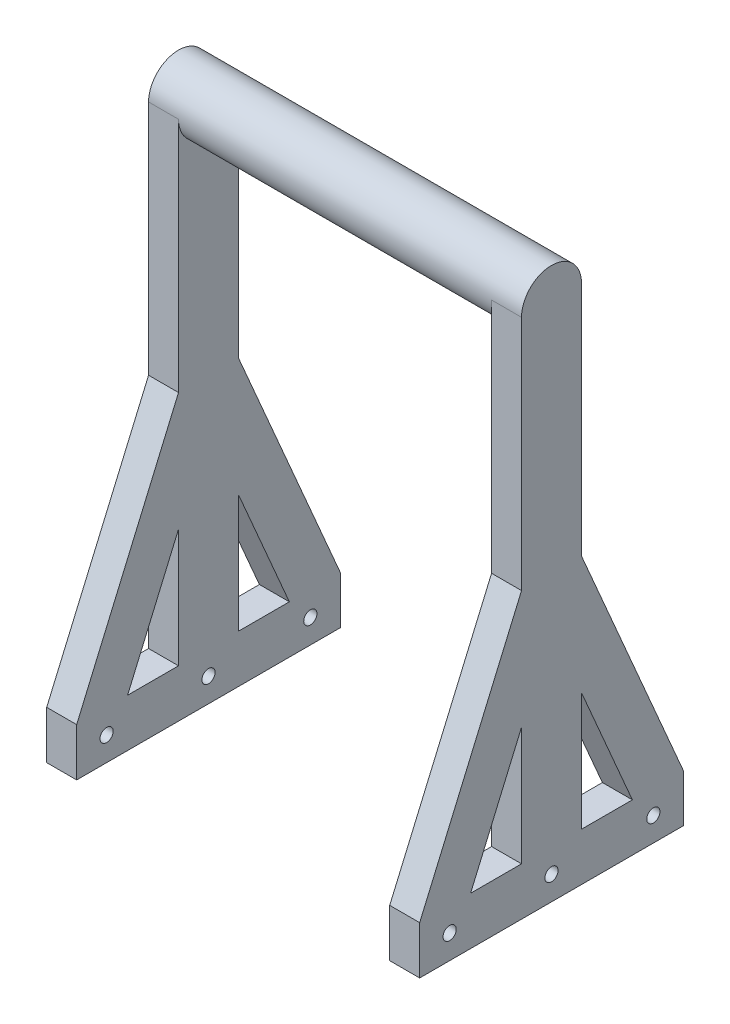
from build123d import *

# Parameters (mm, degrees)
SKETCH_2_W          = 10
SKETCH_2_H          = 88
EXTRUDE_1_DEPTH     = 16
EXTRUDE_1_2_DEPTH   = 16
SKETCH_3_W          = 10
SKETCH_3_H          = 20
EXTRUDE_2_DEPTH     = 158
SKETCH_4_R          = 10
EXTRUDE_3_DEPTH     = 124.5
SKETCH_5_R          = 2.2
CUT_EXTRUDE_1_DEPTH = 126
EXTRUDE_4_DEPTH     = 10
EXTRUDE_5_DEPTH     = 10


with BuildPart() as part:
    # 草图2 → 凸台-拉伸1 (new body)
    with BuildSketch(Plane(origin=(0, 0, 0), x_dir=(1, 0, 0), z_dir=(0, 1, 0))):
        with Locations((-57.25, 0)):
            Rectangle(SKETCH_2_W, SKETCH_2_H)
    extrude(amount=EXTRUDE_1_DEPTH)



with BuildPart() as body_2:
    # 草图2 → Extrude 1 2 (new body)
    with BuildSketch(Plane(origin=(0, 0, 0), x_dir=(1, 0, 0), z_dir=(0, 1, 0))):
        with Locations((57.25, 0)):
            Rectangle(SKETCH_2_W, SKETCH_2_H)
    extrude(amount=EXTRUDE_1_2_DEPTH)


with BuildPart() as part_1:
    add(part.part)

    add(body_2.part)  # 凸台-拉伸2 merges body 2
    # 草图3 → 凸台-拉伸2 (add)
    with BuildSketch(Plane(origin=(0, 16, 0), x_dir=(1, 0, 0), z_dir=(0, 1, 0))):
        with Locations((-57.25, 0)):
            Rectangle(SKETCH_3_W, SKETCH_3_H)
        with Locations((57.25, 0)):
            Rectangle(SKETCH_3_W, SKETCH_3_H)
    extrude(amount=EXTRUDE_2_DEPTH)

    # 草图4 → 凸台-拉伸3 (add)
    with BuildSketch(Plane.ZY.offset(62.25)):
        with Locations((0, 174)):
            Circle(SKETCH_4_R)
    extrude(amount=-EXTRUDE_3_DEPTH)

    # 草图5 → 切除-拉伸1 (cut)
    with BuildSketch(Plane.ZY.offset(62.25)):
        with Locations((0, 8)):
            Circle(SKETCH_5_R)
        with Locations((-34, 8)):
            Circle(SKETCH_5_R)
        with Locations((34, 8)):
            Circle(SKETCH_5_R)
    extrude(amount=-CUT_EXTRUDE_1_DEPTH, mode=Mode.SUBTRACT)

    # 草图6 → 凸台-拉伸4 (add)
    with BuildSketch(Plane.ZY.offset(62.25)):
        Polygon((-44, 16), (-10, 95), (-10, 55.5), (-27, 16), align=None)
        Polygon((44, 16), (10, 95), (10, 55.5), (27, 16), align=None)
    extrude(amount=-EXTRUDE_4_DEPTH)

    # 草图7 → 凸台-拉伸5 (add)
    with BuildSketch(Plane(origin=(62.25, 0, 0), x_dir=(0, 0, -1), z_dir=(1, 0, 0))):
        Polygon((-44, 16), (-10, 95), (-10, 55.5), (-27, 16), align=None)
        Polygon((44, 16), (10, 95), (10, 55.5), (27, 16), align=None)
    extrude(amount=-EXTRUDE_5_DEPTH)


solid = part_1.part
